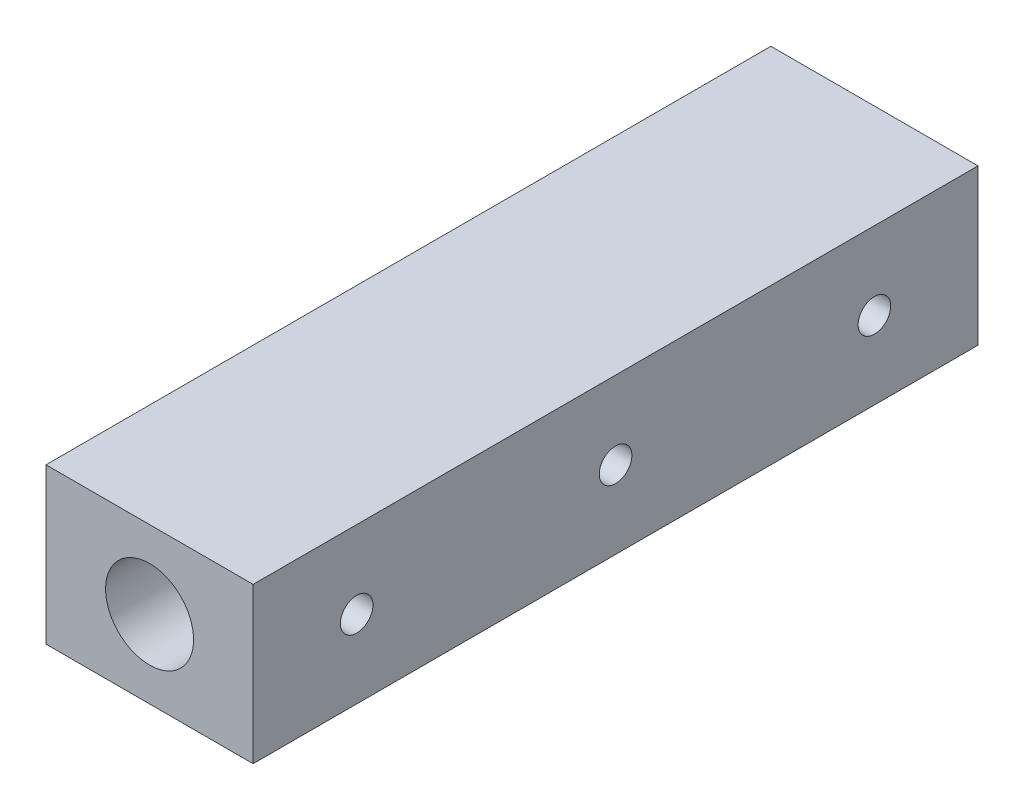
from build123d import *

# Parameters (mm, degrees)
SKETCH_1_W          = 20
SKETCH_1_H          = 15
EXTRUDE_1_DEPTH     = 70
SKETCH_2_R          = 4.25
CUT_EXTRUDE_1_DEPTH = 75.330343737
SKETCH_3_R          = 1.575
CUT_EXTRUDE_2_DEPTH = 75.330343737


with BuildPart() as part:
    # 草图1 → 凸台-拉伸1 (new body)
    with BuildSketch(Plane.XY):
        with Locations((10, -7.5)):
            Rectangle(SKETCH_1_W, SKETCH_1_H)
    extrude(amount=EXTRUDE_1_DEPTH)

    # 草图2 → 切除-拉伸1 (cut, through all)
    with BuildSketch(Plane(origin=(0, 0, 0), x_dir=(-1, 0, 0), z_dir=(0, 0, -1))):
        with Locations((-10, -7.5)):
            Circle(SKETCH_2_R)
    extrude(amount=-CUT_EXTRUDE_1_DEPTH, mode=Mode.SUBTRACT)

    # 草图3 → 切除-拉伸2 (cut, through all)
    with BuildSketch(Plane(origin=(20, 0, 0), x_dir=(0, 0, -1), z_dir=(1, 0, 0))):
        with Locations(Location((-60, -7.5, 0), (0, 0, 90))):
            Circle(SKETCH_3_R)
        with Locations(Location((-35, -7.5, 0), (0, 0, 90))):
            Circle(SKETCH_3_R)
        with Locations(Location((-10, -7.5, 0), (0, 0, 90))):
            Circle(SKETCH_3_R)
    extrude(amount=-CUT_EXTRUDE_2_DEPTH, mode=Mode.SUBTRACT)


solid = part.part
